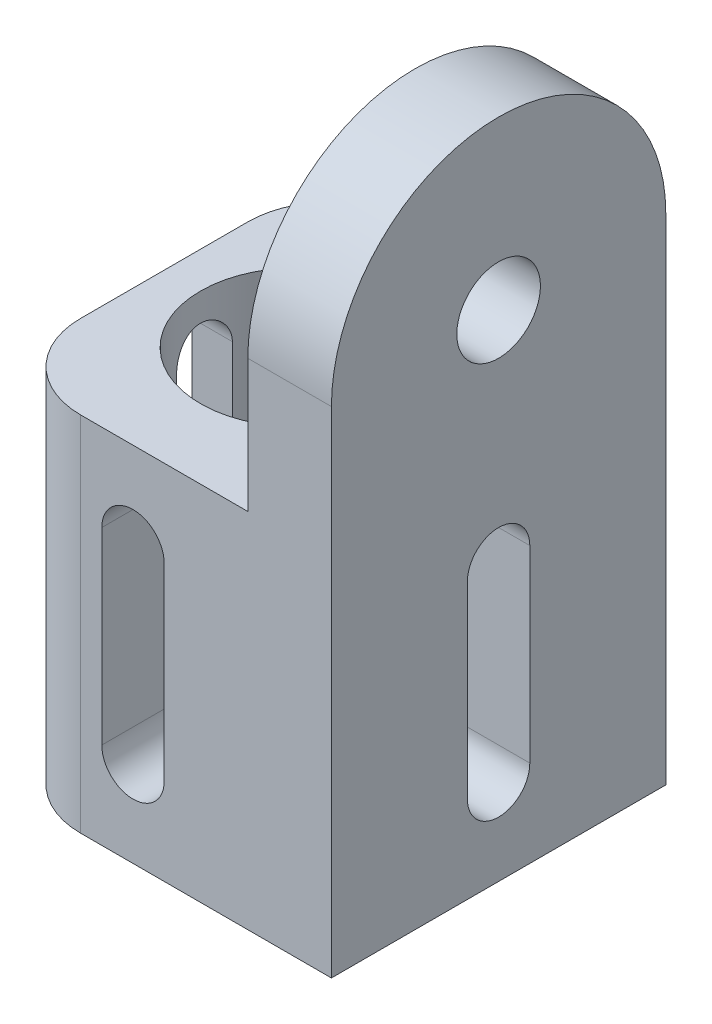
from build123d import *

# Parameters (mm, degrees)
BOSS_EXTRUDE1_DEPTH         = 38.1
CUT_EXTRUDE1_DEPTH          = 186.408865419
CUT_EXTRUDE2_DEPTH          = 30.988
CUT_EXTRUDE3_DEPTH          = 38.1
SKETCH5_R                   = 22.225
CUT_EXTRUDE4_DEPTH          = 69.85
CUT_EXTRUDE5_DEPTH          = 166.774846991
F_3_4_0_75_DIAMETER_HOLE1_D = 19.05
FILLET1_R                   = 19.05


with BuildPart() as part:
    # Sketch1 → Boss-Extrude1 (new, symmetric)
    with BuildSketch(Plane.XY):
        Polygon((0, 0), (0, 150.876), (-19.05, 150.876), (-19.05, 82.55), (-76.2, 82.55), (-76.2, 0), align=None)
    extrude(amount=BOSS_EXTRUDE1_DEPTH, both=True)

    # Sketch2 → Cut-Extrude1 (cut, through all)
    with BuildSketch(Plane.XY.offset(38.1)):
        with BuildLine():
            Line((-38.1, 62.738), (-38.1, 19.812))
            ThreePointArc((-38.1, 19.812), (-45.212, 12.7), (-52.324, 19.812))
            Line((-52.324, 19.812), (-52.324, 62.738))
            ThreePointArc((-52.324, 62.738), (-45.212, 69.85), (-38.1, 62.738))
        make_face()
    extrude(amount=-CUT_EXTRUDE1_DEPTH, mode=Mode.SUBTRACT)

    # Sketch3 → Cut-Extrude2 (cut)
    with BuildSketch(Plane.ZY.offset(76.2)):
        with BuildLine():
            Line((6.35, 69.85), (6.35, 25.4))
            ThreePointArc((6.35, 25.4), (0, 19.05), (-6.35, 25.4))
            Line((-6.35, 25.4), (-6.35, 69.85))
            ThreePointArc((-6.35, 69.85), (0, 76.2), (6.35, 69.85))
        make_face()
    extrude(amount=-CUT_EXTRUDE2_DEPTH, mode=Mode.SUBTRACT)

    # Sketch4 → Cut-Extrude3 (cut)
    with BuildSketch(Plane(origin=(0, 0, 0), x_dir=(0, 0, -1), z_dir=(1, 0, 0))):
        with BuildLine():
            Line((-7.112, 19.812), (-7.112, 62.738))
            ThreePointArc((-7.112, 62.738), (0, 69.85), (7.112, 62.738))
            Line((7.112, 62.738), (7.112, 19.812))
            ThreePointArc((7.112, 19.812), (0, 12.7), (-7.112, 19.812))
        make_face()
    extrude(amount=-CUT_EXTRUDE3_DEPTH, mode=Mode.SUBTRACT)

    # Sketch5 → Cut-Extrude4 (cut)
    with BuildSketch(Plane(origin=(0, 82.55, 0), x_dir=(1, 0, 0), z_dir=(0, 1, 0))):
        with Locations(Location((-45.72, 0, 0), (0, 0, 180))):
            Circle(SKETCH5_R)
    extrude(amount=-CUT_EXTRUDE4_DEPTH, mode=Mode.SUBTRACT)

    # Sketch6 → Cut-Extrude5 (cut, through all)
    with BuildSketch(Plane.ZY.offset(19.05)):
        with BuildLine():
            Line((-38.1, 150.876), (-38.1, 112.776))
            ThreePointArc((-38.1, 112.776), (-26.940768319, 139.716768407), (1.24e-07, 150.876))
            Line((1.24e-07, 150.876), (-38.1, 150.876))
        make_face()
        with BuildLine():
            Line((38.1, 150.876), (1.24e-07, 150.876))
            ThreePointArc((1.24e-07, 150.876), (26.940768407, 139.716768319), (38.1, 112.776))
            Line((38.1, 112.776), (38.1, 150.876))
        make_face()
    extrude(amount=-CUT_EXTRUDE5_DEPTH, mode=Mode.SUBTRACT)

    # 3/4 (0.75) Diameter Hole1 (through all)
    with Locations(Plane.ZY.offset(19.05)):
        with Locations((0, 112.776)):
            Hole(F_3_4_0_75_DIAMETER_HOLE1_D / 2)

    # Fillet1
    fillet1_edges = [part.edges().sort_by_distance(p)[0] for p in [
        (-76.2, 41.275, 38.1),
        (-76.2, 41.275, -38.1),
    ]]
    fillet(fillet1_edges, radius=FILLET1_R)


solid = part.part
